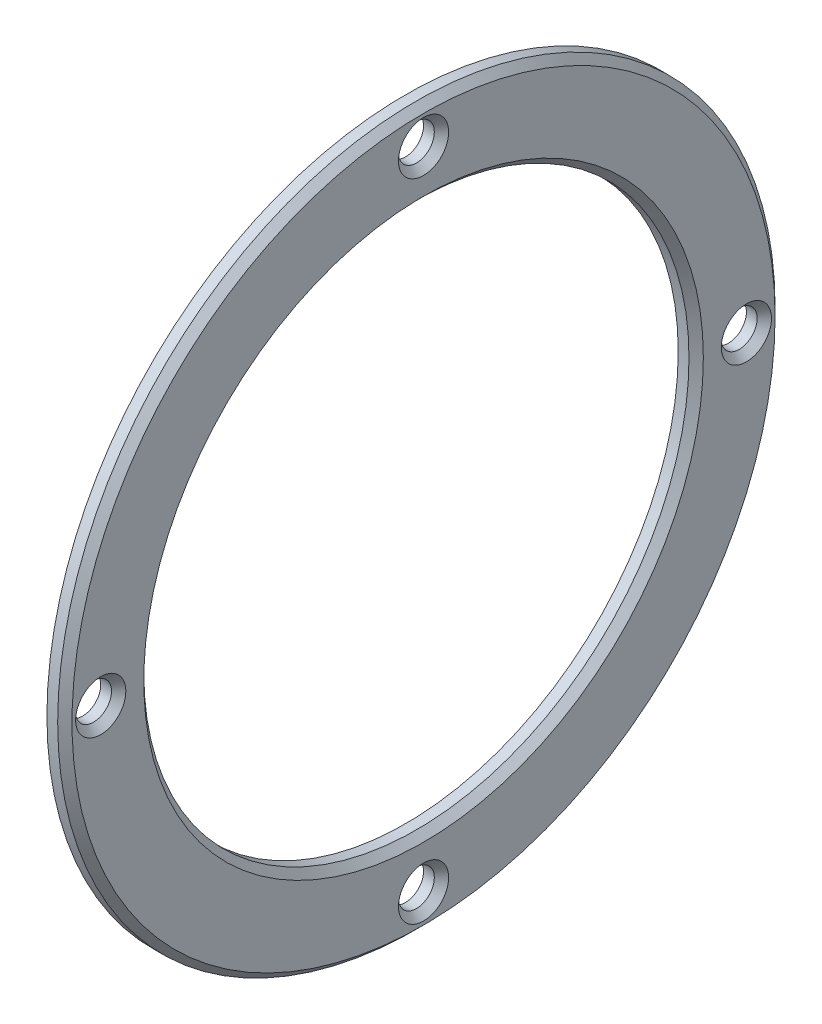
from build123d import *

# Parameters (mm, degrees)
SKETCH1_R           = 50
SKETCH1_R_2         = 38
SKETCH1_R_3         = 2.5
BOSS_EXTRUDE1_DEPTH = 2.5
CHAMFER1_SIZE       = 1


with BuildPart() as part:
    # Sketch1 → Boss-Extrude1 (new body)
    with BuildSketch(Plane(origin=(0, 0, 0), x_dir=(0, 0, -1), z_dir=(1, 0, 0))):
        Circle(SKETCH1_R)
        Circle(SKETCH1_R_2, mode=Mode.SUBTRACT)
        with Locations((0, 45)):
            Circle(SKETCH1_R_3, mode=Mode.SUBTRACT)
        with Locations((45, 0)):
            Circle(SKETCH1_R_3, mode=Mode.SUBTRACT)
        with Locations((0, -45)):
            Circle(SKETCH1_R_3, mode=Mode.SUBTRACT)
        with Locations((-45, 0)):
            Circle(SKETCH1_R_3, mode=Mode.SUBTRACT)
    extrude(amount=BOSS_EXTRUDE1_DEPTH)

    # Chamfer1
    chamfer1_edges = [part.edges().sort_by_distance(p)[0] for p in [
        (2.5, 0, -42.5),
        (2.5, -45, 2.5),
        (2.5, 0, 47.5),
        (2.5, 0, 50),
        (2.5, 0, 38),
        (2.5, 45, 2.5),
    ]]
    chamfer(chamfer1_edges, length=CHAMFER1_SIZE)


solid = part.part
